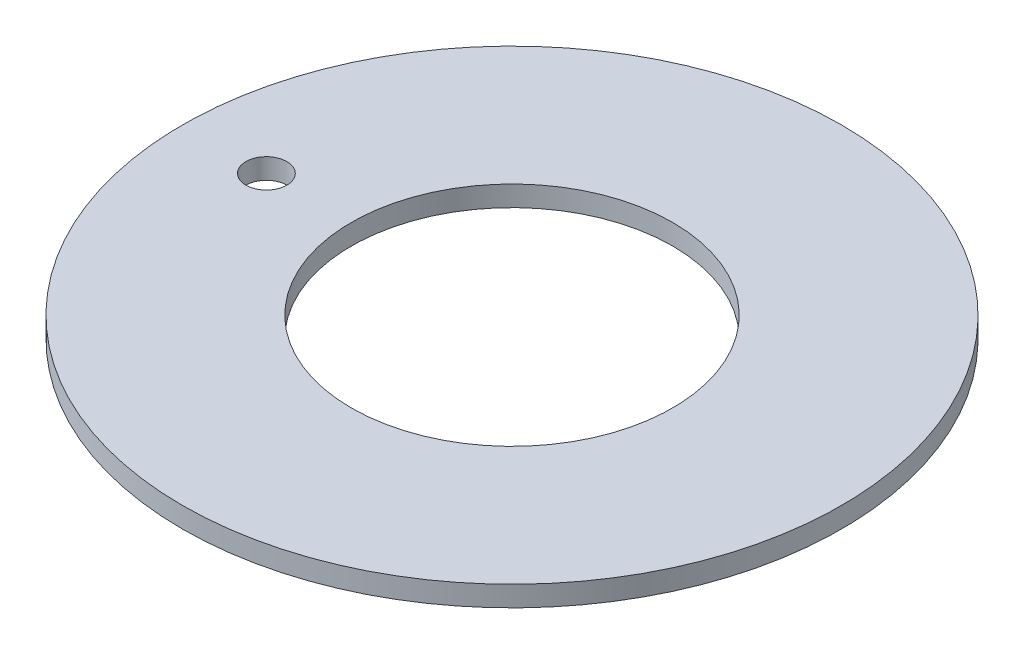
from build123d import *

# Parameters (mm, degrees)
SKETCH1_R           = 32.2
SKETCH1_R_2         = 15.7
BOSS_EXTRUDE1_DEPTH = 2
SKETCH2_R           = 2
CUT_EXTRUDE1_DEPTH  = 46.581575225


with BuildPart() as part:
    # Sketch1 → Boss-Extrude1 (new body)
    with BuildSketch(Plane(origin=(0, 0, 0), x_dir=(1, 0, 0), z_dir=(0, 1, 0))):
        with Locations(Location((0, 0, 0), (0, 0, 270))):
            Circle(SKETCH1_R)
        with Locations(Location((0, 0, 0), (0, 0, 270))):
            Circle(SKETCH1_R_2, mode=Mode.SUBTRACT)
    extrude(amount=BOSS_EXTRUDE1_DEPTH)

    # Sketch2 → Cut-Extrude1 (cut, through all)
    with BuildSketch(Plane(origin=(0, 2, 0), x_dir=(1, 0, 0), z_dir=(0, 1, 0))):
        with Locations(Location((-24, 0, 0), (0, 0, 270))):
            Circle(SKETCH2_R)
    extrude(amount=-CUT_EXTRUDE1_DEPTH, mode=Mode.SUBTRACT)


solid = part.part
